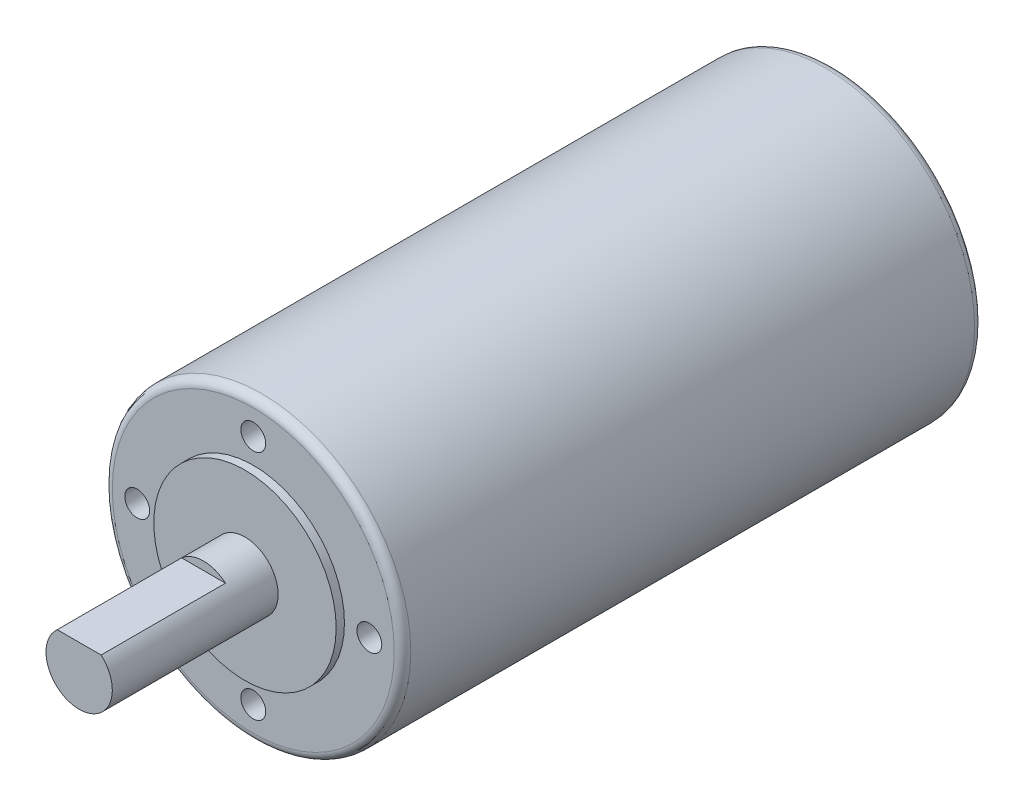
from build123d import *

# Parameters (mm, degrees)
SKETCH1_R           = 18
SKETCH1_R_2         = 1.5
GEAR_DEPTH          = 20
SKETCH2_R           = 18
MOTOR_DEPTH         = 50
SKETCH3_R           = 6.5
BOSS_EXTRUDE3_DEPTH = 3.7
SKETCH4_R           = 11
BOSS_EXTRUDE4_DEPTH = 1
SKETCH5_R           = 4
SHAFT_DEPTH         = 20
CUT_EXTRUDE1_DEPTH  = 15
FILLET1_R           = 1


with BuildPart() as part:
    # Sketch1 → Gear (new body)
    with BuildSketch(Plane.XY):
        Circle(SKETCH1_R)
        with Locations((0, 14)):
            Circle(SKETCH1_R_2, mode=Mode.SUBTRACT)
        with Locations((14, 0)):
            Circle(SKETCH1_R_2, mode=Mode.SUBTRACT)
        with Locations((0, -14)):
            Circle(SKETCH1_R_2, mode=Mode.SUBTRACT)
        with Locations((-14, 0)):
            Circle(SKETCH1_R_2, mode=Mode.SUBTRACT)
    extrude(amount=-GEAR_DEPTH)

    # Sketch2 → Motor (add)
    with BuildSketch(Plane(origin=(0, 0, -20), x_dir=(-1, 0, 0), z_dir=(0, 0, -1))):
        with Locations(Location((0, 0, 0), (0, 0, 180))):
            Circle(SKETCH2_R)
    extrude(amount=MOTOR_DEPTH)

    # Sketch3 → Boss-Extrude3 (add)
    with BuildSketch(Plane(origin=(0, 0, -70), x_dir=(-1, 0, 0), z_dir=(0, 0, -1))):
        Circle(SKETCH3_R)
    extrude(amount=BOSS_EXTRUDE3_DEPTH)

    # Sketch4 → Boss-Extrude4 (add)
    with BuildSketch(Plane.XY):
        Circle(SKETCH4_R)
    extrude(amount=BOSS_EXTRUDE4_DEPTH)

    # Sketch5 → shaft (add)
    with BuildSketch(Plane.XY.offset(1)):
        Circle(SKETCH5_R)
    extrude(amount=SHAFT_DEPTH)

    # Sketch6 → Cut-Extrude1 (cut)
    with BuildSketch(Plane.XY.offset(21)):
        Polygon((-71.543868334, 3), (-2.645751311, 3), (2.645751311, 3), (71.543868334, 3), (71.543868334, 140.796234045), (-71.543868334, 140.796234045), align=None)
    extrude(amount=-CUT_EXTRUDE1_DEPTH, mode=Mode.SUBTRACT)

    # Fillet1
    fillet1_edges = [part.edges().sort_by_distance(p)[0] for p in [
        (-18, 0, 0),
        (-18, 0, -70),
    ]]
    fillet(fillet1_edges, radius=FILLET1_R)


solid = part.part
